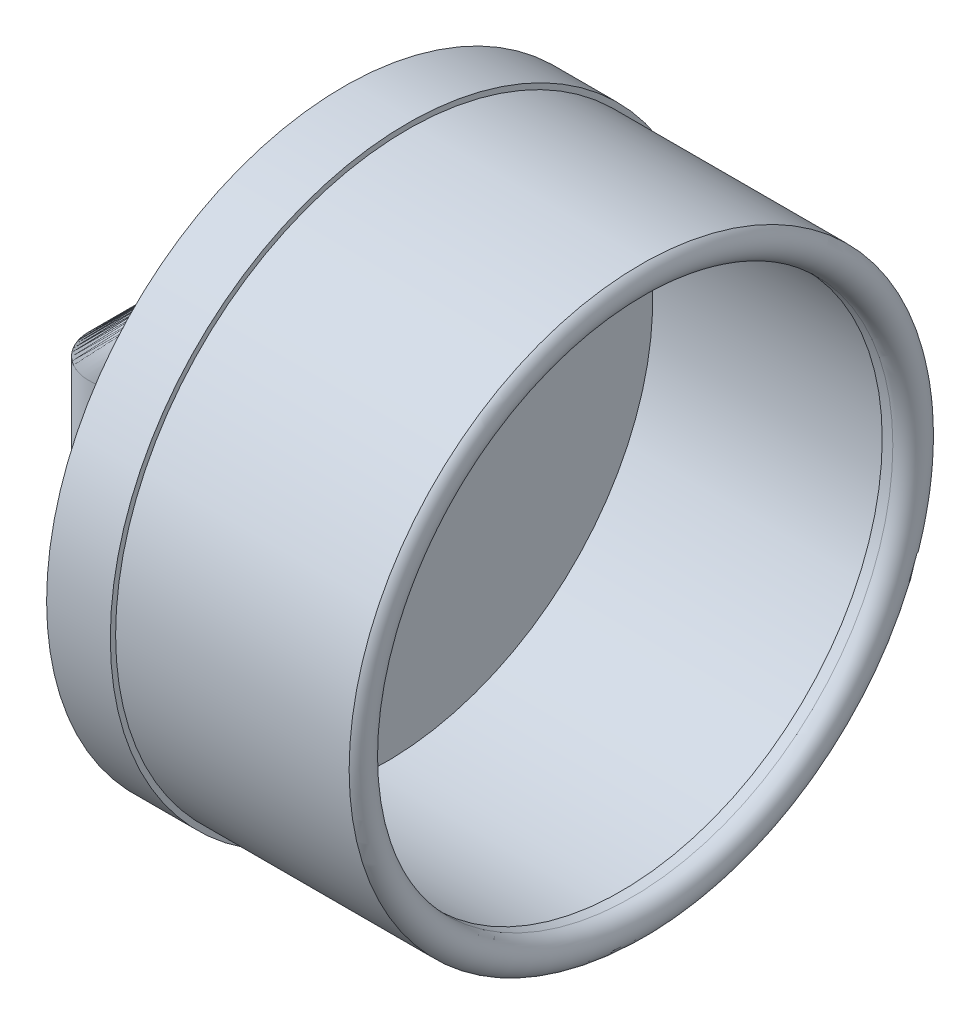
from build123d import *

# Parameters (mm, degrees)
SKETCH2_R           = 14
BOSS_EXTRUDE1_DEPTH = 2
SKETCH3_R           = 2


with BuildPart() as part:
    # Sketch1 → Revolve1 (revolve)
    with BuildSketch(Plane(origin=(0, 0, 0), x_dir=(-1, 0, 0), z_dir=(0, 0, -1)), mode=Mode.PRIVATE) as revolve1_sk:
        with BuildLine():
            Line((-11.972812665, 3.766736765), (-11.972812665, 4.016736765))
            Line((-11.972812665, 4.016736765), (-0.912123334, 4.016736765))
            Line((-0.912123334, 4.016736765), (-0.912123334, 5.466736765))
            Line((-0.912123334, 5.466736765), (-1.912123334, 5.466736765))
            Line((-1.912123334, 5.466736765), (-1.912123334, 5.216736765))
            Line((-1.912123334, 5.216736765), (-12.912123334, 5.216736765))
            ThreePointArc((-12.912123334, 5.216736765), (-13.230357031, 4.328770979), (-12.472812665, 3.766736765))
            Line((-12.472812665, 3.766736765), (-11.972812665, 3.766736765))
        make_face()
    revolve(revolve1_sk.sketch.rotate(Axis((12.175741694, -8.533263235, 0), (-1, 0, 0)), 270), axis=Axis((12.175741694, -8.533263235, 0), (-1, 0, 0)))

    # Sketch2 → Boss-Extrude1 (add)
    with BuildSketch(Plane.ZY.offset(-0.912123334)):
        with Locations((0, -8.533263235)):
            Circle(SKETCH2_R)
    extrude(amount=BOSS_EXTRUDE1_DEPTH)

    # Sweep1: sweep along a path in Sketch4
    with BuildLine(Plane.XY) as sweep1_path:
        Line((-1.087876666, -8.533263235), (-9.087876666, -8.533263235))
        ThreePointArc((-9.087876666, -8.533263235), (-10.502090228, -9.119049673), (-11.087876666, -10.533263235))
        Line((-11.087876666, -10.533263235), (-11.087876666, -17.533263235))
    # Sketch3 → Sweep1 (sweep)
    with BuildSketch(Plane.ZY.offset(1.087876666)):
        with Locations((0, -8.533263235)):
            Circle(SKETCH3_R)
    sweep(path=sweep1_path.line)


solid = part.part
